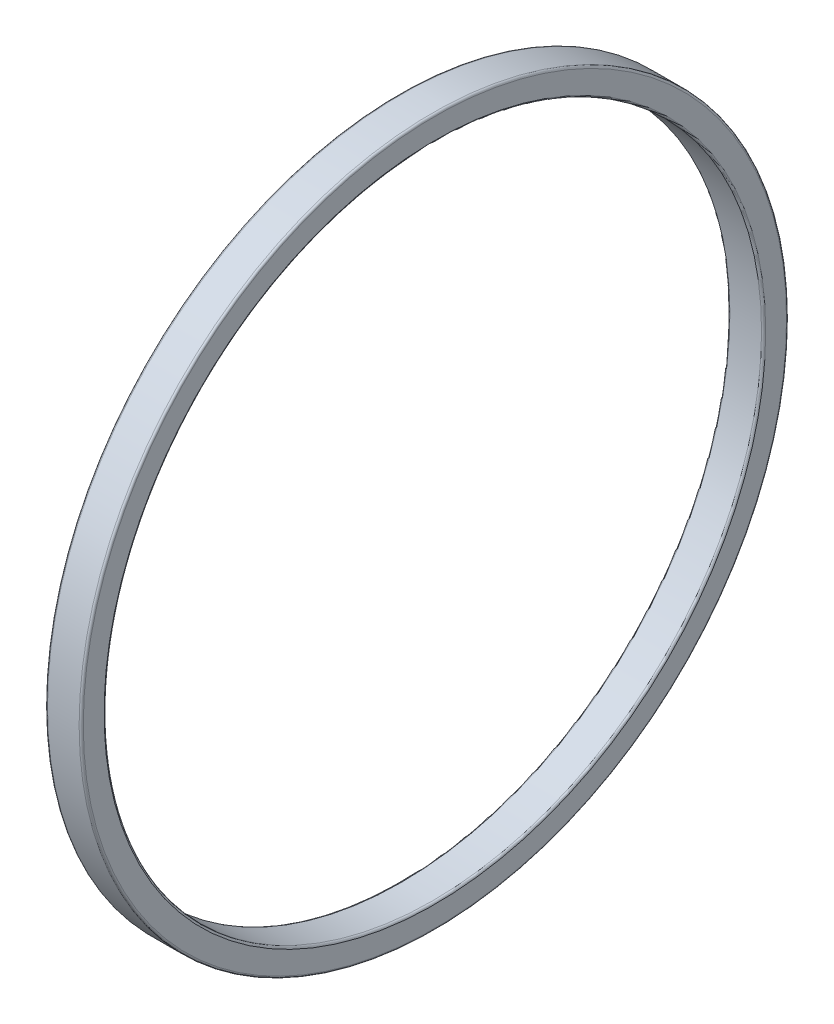
from build123d import *

# Parameters (mm, degrees)
SKETCH1_R           = 42.5
SKETCH1_R_2         = 39.5
BOSS_EXTRUDE1_DEPTH = 2.15
FILLET1_R           = 0.25


with BuildPart() as part:
    # Sketch1 → Boss-Extrude1 (new, symmetric)
    with BuildSketch(Plane(origin=(0, 0, 0), x_dir=(0, 0, -1), z_dir=(1, 0, 0))):
        with Locations(Location((0, 0, 0), (0, 0, 180))):
            Circle(SKETCH1_R)
        with Locations(Location((0, 0, 0), (0, 0, 180))):
            Circle(SKETCH1_R_2, mode=Mode.SUBTRACT)
    extrude(amount=BOSS_EXTRUDE1_DEPTH, both=True)

    # Fillet1
    fillet1_edges = [part.edges().sort_by_distance(p)[0] for p in [
        (-2.15, 0, -42.5),
        (2.15, 0, -42.5),
        (-2.15, 0, -39.5),
        (2.15, 0, -39.5),
    ]]
    fillet(fillet1_edges, radius=FILLET1_R)


solid = part.part
